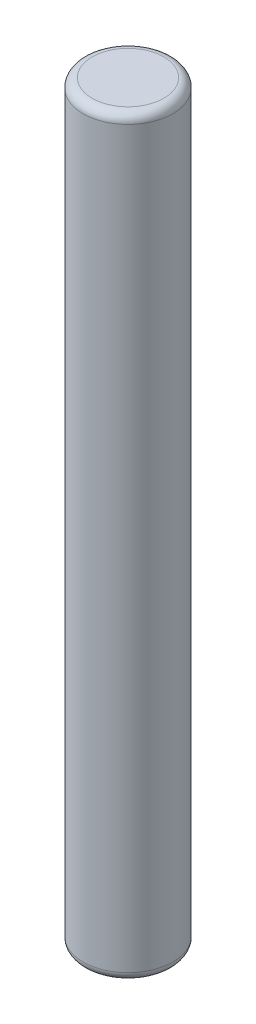
from build123d import *

# Parameters (mm, degrees)
SKETCH_1_R      = 2.5
EXTRUDE_1_DEPTH = 42
FILLET_1_R      = 0.5


with BuildPart() as part:
    # 草图1 → 凸台-拉伸1 (new body)
    with BuildSketch(Plane(origin=(0, 0, 0), x_dir=(1, 0, 0), z_dir=(0, 1, 0))):
        with Locations(Location((0, 0, 0), (0, 0, 90))):
            Circle(SKETCH_1_R)
    extrude(amount=EXTRUDE_1_DEPTH)

    # 圆角1
    fillet_1_edges = [part.edges().sort_by_distance(p)[0] for p in [
        (0, 0, 2.5),
        (0, 42, 2.5),
    ]]
    fillet(fillet_1_edges, radius=FILLET_1_R)


solid = part.part
